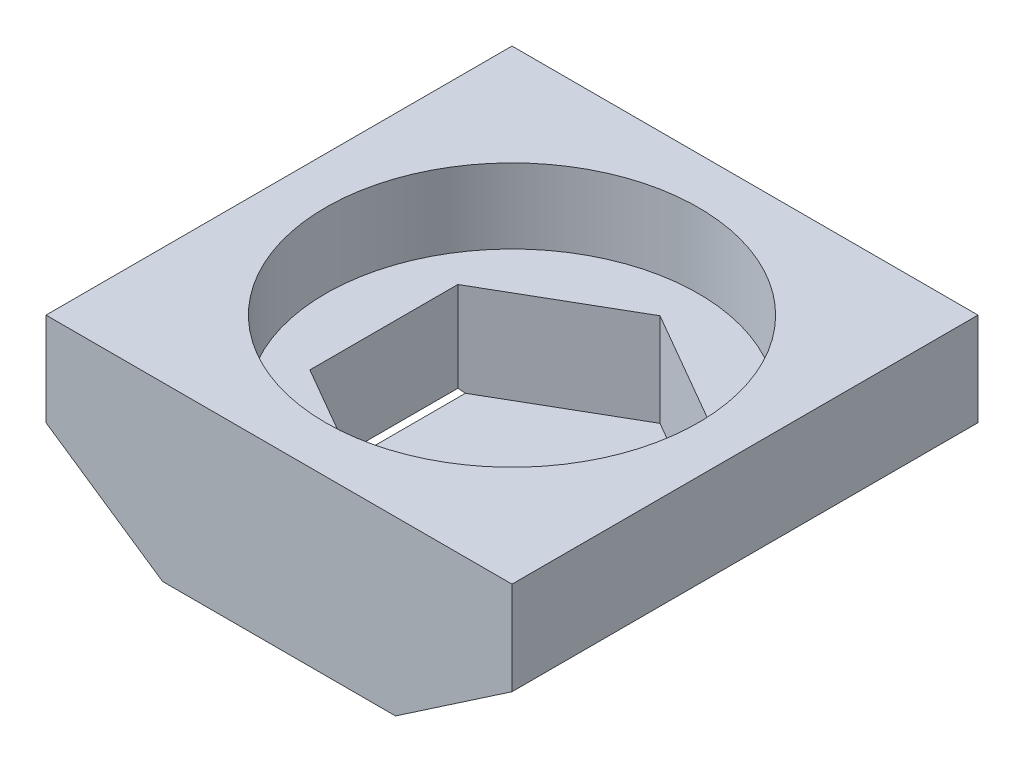
from build123d import *

# Parameters (mm, degrees)
EXTRUDE_1_DEPTH     = 10
CUT_EXTRUDE_1_DEPTH = 3.6
SKETCH_3_R          = 4
CUT_EXTRUDE_2_DEPTH = 1.6


with BuildPart() as part:
    # Эскиз1 → Бобышка-Вытянуть1 (new body)
    with BuildSketch(Plane.XY):
        Polygon((2.5, 0), (-2.5, 0), (-5, 1.7), (-5, 3.7), (5, 3.7), (5, 1.7), align=None)
    extrude(amount=EXTRUDE_1_DEPTH)

    # Эскиз2 → Вырез-Вытянуть1 (cut)
    with BuildSketch(Plane(origin=(0, 3.7, 0), x_dir=(1, 0, 0), z_dir=(0, 1, 0))):
        Polygon((2.75, -6.58771324), (2.75, -3.41228676), (0, -1.824573519), (-2.75, -3.41228676), (-2.75, -6.58771324), (0, -8.175426481), align=None)
    extrude(amount=-CUT_EXTRUDE_1_DEPTH, mode=Mode.SUBTRACT)

    # Эскиз3 → Вырез-Вытянуть2 (cut)
    with BuildSketch(Plane(origin=(0, 3.7, 0), x_dir=(1, 0, 0), z_dir=(0, 1, 0))):
        with Locations(Location((0, -5, 0), (0, 0, 270))):
            Circle(SKETCH_3_R)
    extrude(amount=-CUT_EXTRUDE_2_DEPTH, mode=Mode.SUBTRACT)


solid = part.part
